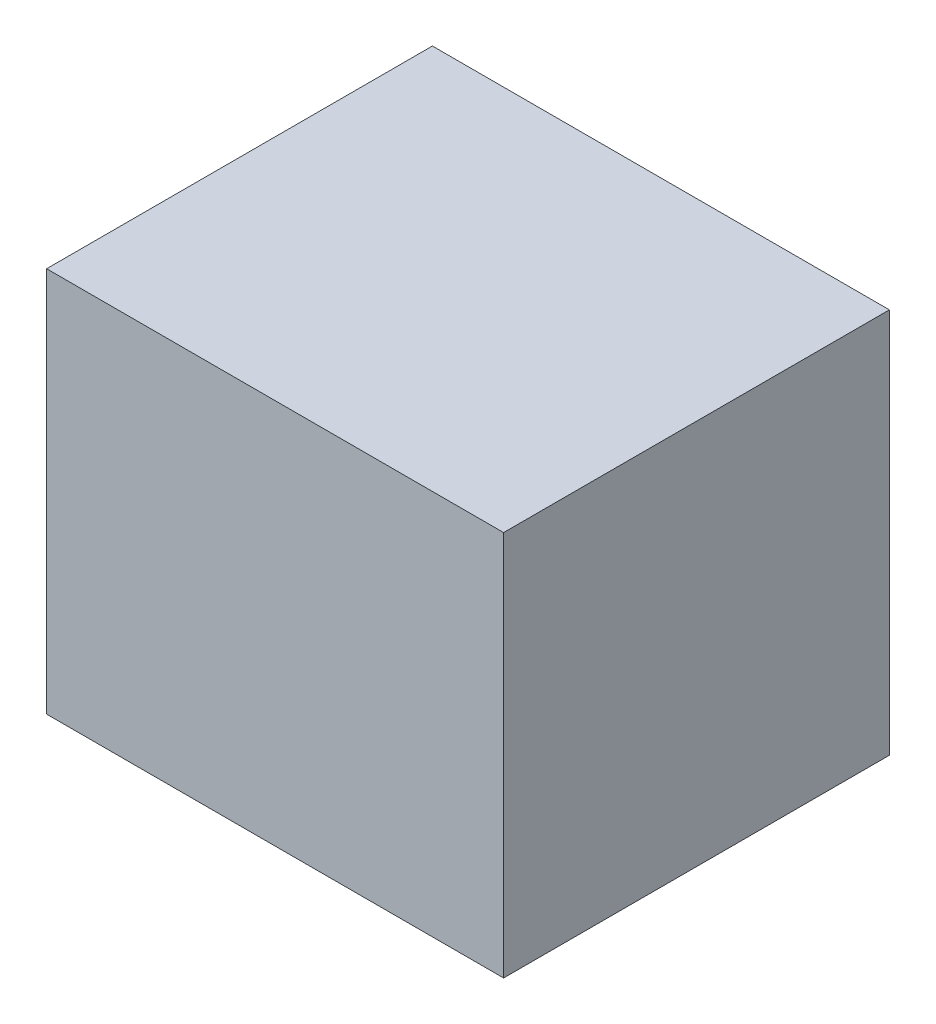
from build123d import *

# Parameters (mm, degrees)
SKETCH1_W           = 244.475
SKETCH1_H           = 206.375
BOSS_EXTRUDE1_DEPTH = 206.375
SHELL1_T            = -3.175


with BuildPart() as part:
    # Sketch1 → Boss-Extrude1 (new body)
    with BuildSketch(Plane.XY):
        Rectangle(SKETCH1_W, SKETCH1_H)
    extrude(amount=-BOSS_EXTRUDE1_DEPTH)

    # Shell1
    shell1_openings = [part.faces().sort_by_distance(p)[0] for p in [
        (0, 0, -206.375),
    ]]
    offset(amount=SHELL1_T, openings=shell1_openings, kind=Kind.INTERSECTION)


solid = part.part
